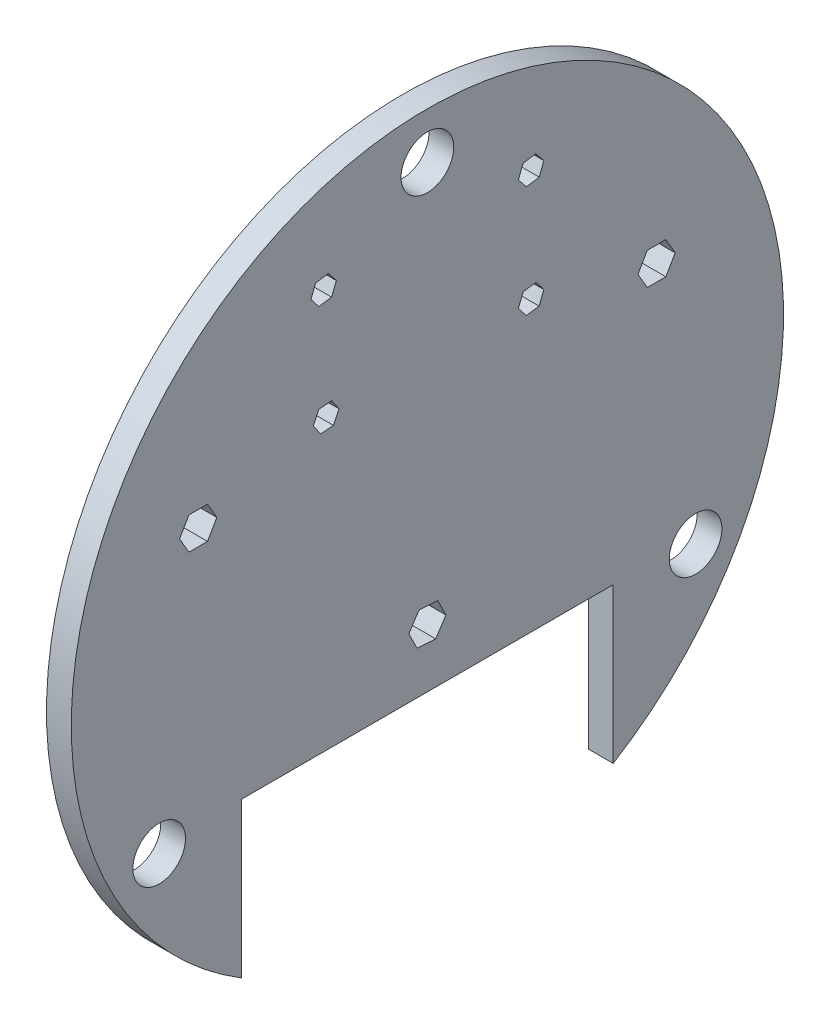
from build123d import *

# Parameters (mm, degrees)
SKETCH1_R           = 57.5
BOSS_EXTRUDE1_DEPTH = 4
SKETCH2_R           = 4.25
CUT_EXTRUDE1_DEPTH  = 82.415600471
CUT_EXTRUDE2_DEPTH  = 82.415600471
CUT_EXTRUDE3_DEPTH  = 82.415600471


with BuildPart() as part:
    # Sketch1 → Boss-Extrude1 (new body)
    with BuildSketch(Plane(origin=(0, 0, 0), x_dir=(0, 0, -1), z_dir=(1, 0, 0))):
        Circle(SKETCH1_R)
    extrude(amount=BOSS_EXTRUDE1_DEPTH)

    # Sketch2 → Cut-Extrude1 (cut, through all)
    with BuildSketch(Plane.ZY):
        with Locations((0, 50)):
            Circle(SKETCH2_R)
        with Locations((43.301270189, -25)):
            Circle(SKETCH2_R)
        with Locations((-43.301270189, -25)):
            Circle(SKETCH2_R)
    extrude(amount=-CUT_EXTRUDE1_DEPTH, mode=Mode.SUBTRACT)

    # Sketch3 → Cut-Extrude2 (cut, through all)
    with BuildSketch(Plane.ZY):
        with BuildLine():
            Line((-30, -49.053542176), (-30, -24.053542176))
            Line((-30, -24.053542176), (30, -24.053542176))
            Line((30, -24.053542176), (30, -49.053542176))
            ThreePointArc((30, -49.053542176), (0, -57.5), (-30, -49.053542176))
        make_face()
    extrude(amount=-CUT_EXTRUDE2_DEPTH, mode=Mode.SUBTRACT)

    # Sketch4 → Cut-Extrude3 (cut, through all)
    with BuildSketch(Plane(origin=(4, 0, 0), x_dir=(0, 0, -1), z_dir=(1, 0, 0))):
        Polygon((15.999329975, 38.578303843), (18.05316756, 38.897288443), (18.803837585, 40.835456267), (17.500670025, 42.454639491), (15.44683244, 42.13565489), (14.696162415, 40.197487066), align=None)
        Polygon((-17.524724067, 38.587792684), (-15.467077039, 38.881201452), (-14.692352971, 40.809880435), (-15.975275933, 42.44515065), (-18.032922961, 42.151741882), (-18.807647029, 40.223062899), align=None)
        Polygon((15.975275933, 20.587792684), (18.032922961, 20.881201452), (18.807647029, 22.809880435), (17.524724067, 24.44515065), (15.467077039, 24.151741882), (14.692352971, 22.223062899), align=None)
        Polygon((-17.245318548, 20.646539693), (-15.172985813, 20.806029616), (-14.27494177, 22.680467371), (-15.449230462, 24.395415203), (-17.521563197, 24.235925281), (-18.41960724, 22.361487526), align=None)
        Polygon((33.9977786, 17.342133915), (35.4988893, 14.742133915), (38.5011107, 14.742133915), (40.0022214, 17.342133915), (38.5011107, 19.942133915), (35.4988893, 19.942133915), align=None)
        Polygon((-40.0022214, 17.342133915), (-38.5011107, 14.742133915), (-35.4988893, 14.742133915), (-33.9977786, 17.342133915), (-35.4988893, 19.942133915), (-38.5011107, 19.942133915), align=None)
        Polygon((-1.657389197, -17.116294048), (1.339206641, -17.299996833), (2.996595839, -14.796720104), (1.657389197, -12.109740591), (-1.339206641, -11.926037806), (-2.996595839, -14.429314535), align=None)
    extrude(amount=-CUT_EXTRUDE3_DEPTH, mode=Mode.SUBTRACT)


solid = part.part
